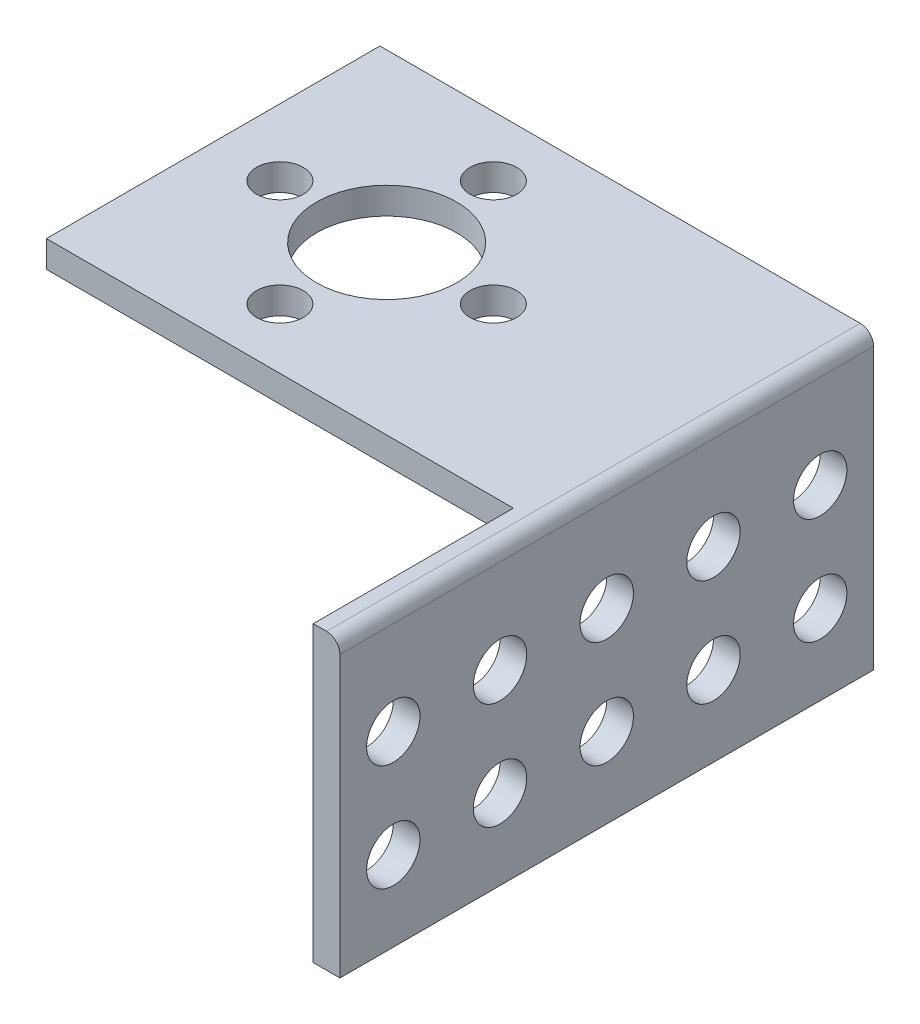
from build123d import *

# Parameters (mm, degrees)
SKETCH1_W           = 35
SKETCH1_H           = 25
SKETCH1_R           = 5.25
SKETCH1_R_2         = 1.75
BOSS_EXTRUDE1_DEPTH = 2
BOSS_EXTRUDE2_DEPTH = 2
SKETCH3_R           = 2
CUT_EXTRUDE1_DEPTH  = 59.043087444
FILLET1_R           = 1
FILLET2_R           = 0.5


with BuildPart() as part:
    # Sketch1 → Boss-Extrude1 (new body)
    with BuildSketch(Plane(origin=(0, 0, 0), x_dir=(1, 0, 0), z_dir=(0, 1, 0))):
        with Locations((17.5, -12.5)):
            Rectangle(SKETCH1_W, SKETCH1_H)
        with Locations(Location((13, -12.5, 0), (0, 0, 270))):
            Circle(SKETCH1_R, mode=Mode.SUBTRACT)
        with Locations(Location((13, -4.5, 0), (0, 0, 270))):
            Circle(SKETCH1_R_2, mode=Mode.SUBTRACT)
        with Locations(Location((21, -12.5, 0), (0, 0, 270))):
            Circle(SKETCH1_R_2, mode=Mode.SUBTRACT)
        with Locations(Location((13, -20.5, 0), (0, 0, 270))):
            Circle(SKETCH1_R_2, mode=Mode.SUBTRACT)
        with Locations(Location((5, -12.5, 0), (0, 0, 270))):
            Circle(SKETCH1_R_2, mode=Mode.SUBTRACT)
    extrude(amount=BOSS_EXTRUDE1_DEPTH)

    # Sketch2 → Boss-Extrude2 (add)
    with BuildSketch(Plane(origin=(35, 0, 0), x_dir=(0, 0, -1), z_dir=(1, 0, 0))):
        Polygon((-25, 2), (-40, 2), (-40, -20), (0, -20), (0, 2), align=None)
    extrude(amount=BOSS_EXTRUDE2_DEPTH)

    # Sketch3 → Cut-Extrude1 (cut, through all)
    with BuildSketch(Plane(origin=(37, 0, 0), x_dir=(0, 0, -1), z_dir=(1, 0, 0))):
        with Locations((-20, -6)):
            Circle(SKETCH3_R)
        with Locations((-12, -6)):
            Circle(SKETCH3_R)
        with Locations((-4, -6)):
            Circle(SKETCH3_R)
        with Locations((-28, -6)):
            Circle(SKETCH3_R)
        with Locations((-36, -6)):
            Circle(SKETCH3_R)
        with Locations((-36, -14)):
            Circle(SKETCH3_R)
        with Locations((-28, -14)):
            Circle(SKETCH3_R)
        with Locations((-20, -14)):
            Circle(SKETCH3_R)
        with Locations((-12, -14)):
            Circle(SKETCH3_R)
        with Locations((-4, -14)):
            Circle(SKETCH3_R)
    extrude(amount=-CUT_EXTRUDE1_DEPTH, mode=Mode.SUBTRACT)

    # Fillet1
    fillet1_edges = [part.edges().sort_by_distance(p)[0] for p in [
        (37, 2, 20),
    ]]
    fillet(fillet1_edges, radius=FILLET1_R)

    # Fillet2
    fillet2_edges = [part.edges().sort_by_distance(p)[0] for p in [
        (35, 0, 12.5),
    ]]
    fillet(fillet2_edges, radius=FILLET2_R)


solid = part.part
